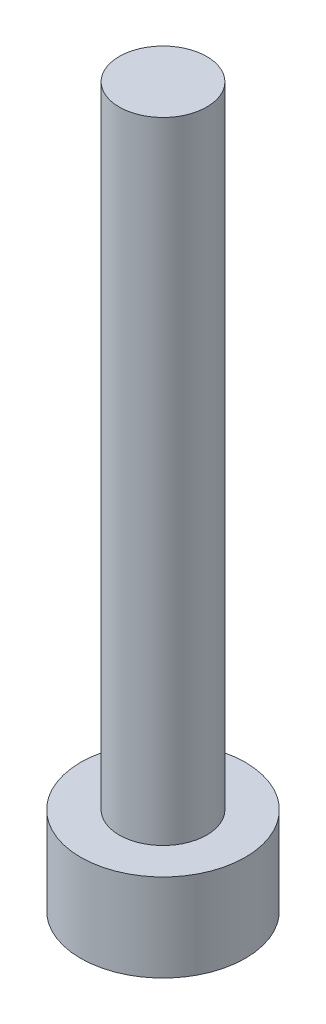
from build123d import *

# Parameters (mm, degrees)
SKETCH_1_R        = 2.35
EXTRUDE_226_DEPTH = 2.5
SKETCH_2_R        = 1.25
EXTRUDE_318_DEPTH = 18


with BuildPart() as part:
    # 草图1 → Extrude 226 (new body)
    with BuildSketch(Plane(origin=(0, 0, 0), x_dir=(1, 0, 0), z_dir=(0, 1, 0))):
        with Locations(Location((0, 0, 0), (0, 0, 270))):
            Circle(SKETCH_1_R)
    extrude(amount=EXTRUDE_226_DEPTH)

    # 草图2 → Extrude 318 (add)
    with BuildSketch(Plane(origin=(0, 2.5, 0), x_dir=(1, 0, 0), z_dir=(0, 1, 0))):
        with Locations(Location((0, 0, 0), (0, 0, 270))):
            Circle(SKETCH_2_R)
    extrude(amount=EXTRUDE_318_DEPTH)


solid = part.part
